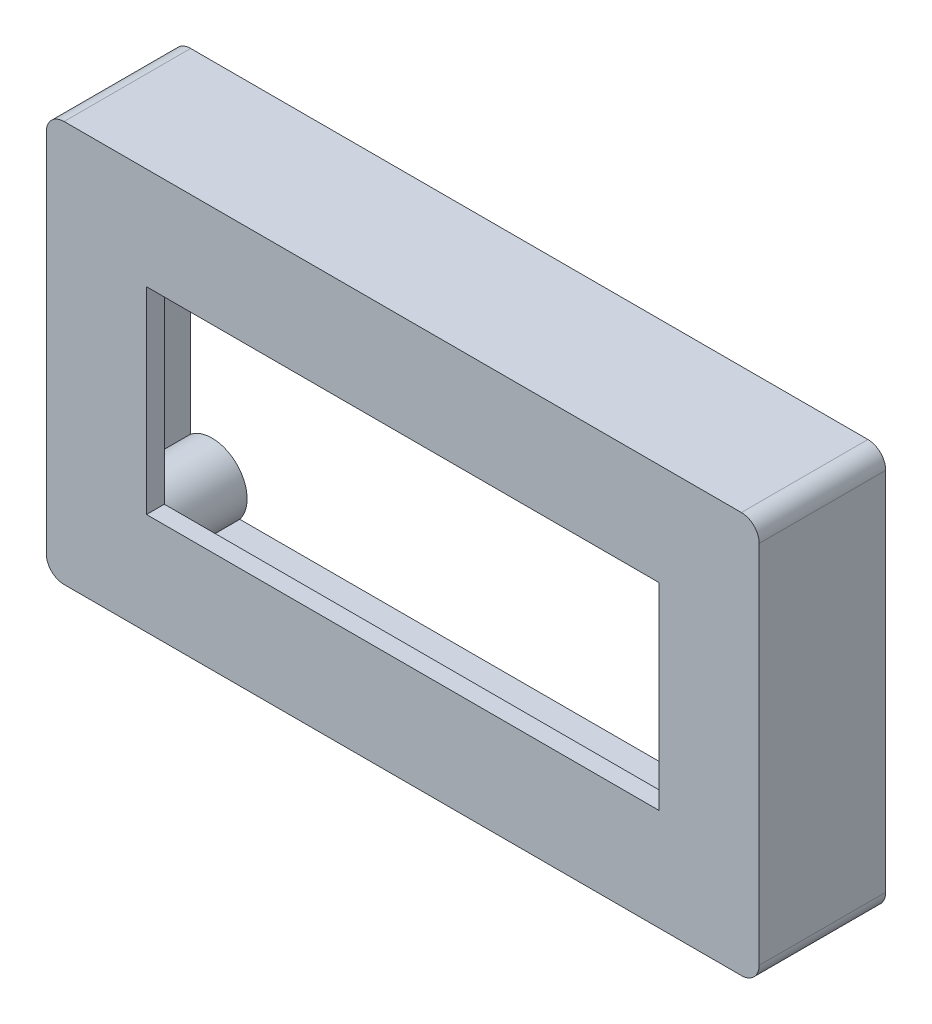
from build123d import *

# Parameters (mm, degrees)
SKETCH1_W           = 101.6
SKETCH1_H           = 57.15
SKETCH1_W_2         = 96.52
SKETCH1_H_2         = 52.07
BOSS_EXTRUDE1_DEPTH = 15.494
SKETCH2_W           = 101.6
SKETCH2_H           = 57.15
SKETCH2_W_2         = 73.025
SKETCH2_H_2         = 28.1178
BOSS_EXTRUDE2_DEPTH = 2.54
SKETCH3_R           = 5
BOSS_EXTRUDE3_DEPTH = 15.494
SKETCH4_R           = 2.415
CUT_EXTRUDE1_DEPTH  = 6.35
SKETCH5_R           = 1.5
CUT_EXTRUDE2_DEPTH  = 7.874
FILLET1_R           = 2.54


with BuildPart() as part:
    # Sketch1 → Boss-Extrude1 (new body)
    with BuildSketch(Plane.XY):
        Rectangle(SKETCH1_W, SKETCH1_H)
        Rectangle(SKETCH1_W_2, SKETCH1_H_2, mode=Mode.SUBTRACT)
    extrude(amount=BOSS_EXTRUDE1_DEPTH)

    # Sketch2 → Boss-Extrude2 (add)
    with BuildSketch(Plane.XY.offset(15.494)):
        Rectangle(SKETCH2_W, SKETCH2_H)
        Rectangle(SKETCH2_W_2, SKETCH2_H_2, mode=Mode.SUBTRACT)
    extrude(amount=BOSS_EXTRUDE2_DEPTH)

    # Sketch3 → Boss-Extrude3 (add)
    with BuildSketch(Plane(origin=(0, 0, 15.494), x_dir=(-1, 0, 0), z_dir=(0, 0, -1))):
        with BuildLine():
            ThreePointArc((-48.26, 19.023454113), (-43.002927797, 18.501467702), (-40.212, 22.987))
            ThreePointArc((-40.212, 22.987), (-40.478199759, 24.59670037), (-41.248454113, 26.035))
            Line((-41.248454113, 26.035), (-48.26, 26.035))
            Line((-48.26, 26.035), (-48.26, 19.023454113))
        make_face()
        with BuildLine():
            Line((-48.26, 26.035), (-41.248454113, 26.035))
            ThreePointArc((-41.248454113, 26.035), (-48.747533906, 26.522533906), (-48.26, 19.023454113))
            Line((-48.26, 19.023454113), (-48.26, 26.035))
        make_face()
        with BuildLine():
            Line((48.26, 26.035), (41.248454113, 26.035))
            ThreePointArc((41.248454113, 26.035), (41.676466094, 19.451466094), (48.26, 19.023454113))
            Line((48.26, 19.023454113), (48.26, 26.035))
        make_face()
        with BuildLine():
            ThreePointArc((50.212, 22.987), (46.82170037, 27.720800241), (41.248454113, 26.035))
            Line((41.248454113, 26.035), (48.26, 26.035))
            Line((48.26, 26.035), (48.26, 19.023454113))
            ThreePointArc((48.26, 19.023454113), (49.697532298, 20.777927797), (50.212, 22.987))
        make_face()
        with BuildLine():
            Line((-48.26, -26.035), (-48.26, -19.023454113))
            ThreePointArc((-48.26, -19.023454113), (-48.747533906, -26.522533906), (-41.248454113, -26.035))
            Line((-41.248454113, -26.035), (-48.26, -26.035))
        make_face()
        with BuildLine():
            ThreePointArc((-40.212, -22.987), (-43.002927797, -18.501467702), (-48.26, -19.023454113))
            Line((-48.26, -19.023454113), (-48.26, -26.035))
            Line((-48.26, -26.035), (-41.248454113, -26.035))
            ThreePointArc((-41.248454113, -26.035), (-40.478199759, -24.59670037), (-40.212, -22.987))
        make_face()
        with Locations((45.212, -22.987)):
            Circle(SKETCH3_R)
    extrude(amount=BOSS_EXTRUDE3_DEPTH)

    # Sketch4 → Cut-Extrude1 (cut)
    with BuildSketch(Plane(origin=(0, 0, 0), x_dir=(-1, 0, 0), z_dir=(0, 0, -1))):
        with Locations((-45.212, 22.987)):
            Circle(SKETCH4_R)
        with Locations((-45.212, -22.987)):
            Circle(SKETCH4_R)
        with Locations((45.212, -22.987)):
            Circle(SKETCH4_R)
        with Locations((45.212, 22.987)):
            Circle(SKETCH4_R)
    extrude(amount=-CUT_EXTRUDE1_DEPTH, mode=Mode.SUBTRACT)

    # Sketch5 → Cut-Extrude2 (cut)
    with BuildSketch(Plane(origin=(0, 0, 6.35), x_dir=(-1, 0, 0), z_dir=(0, 0, -1))):
        with Locations((-45.212, 22.987)):
            Circle(SKETCH5_R)
        with Locations((45.212, -22.987)):
            Circle(SKETCH5_R)
        with Locations((-45.212, -22.987)):
            Circle(SKETCH5_R)
        with Locations((45.212, 22.987)):
            Circle(SKETCH5_R)
    extrude(amount=-CUT_EXTRUDE2_DEPTH, mode=Mode.SUBTRACT)

    # Sketch6 → Cut-Revolve1 (revolve, cut)
    with BuildSketch(Plane(origin=(0, 22.987, 0), x_dir=(0, 0, -1), z_dir=(0, -1, 0)), mode=Mode.PRIVATE) as cut_revolve1_sk:
        Polygon((0, 48.012), (-6.35, 46.892323673), (-6.35, 45.212), (0, 45.212), align=None)
    revolve(cut_revolve1_sk.sketch.rotate(Axis((45.212, 22.987, 6.35), (0, 0, -1)), 180), axis=Axis((45.212, 22.987, 6.35), (0, 0, -1)), mode=Mode.SUBTRACT)

    # Sketch7 → Cut-Revolve2 (revolve, cut)
    with BuildSketch(Plane(origin=(0, -22.987, 0), x_dir=(0, 0, -1), z_dir=(0, 1, 0))):
        Polygon((0, 48.006), (-6.35, 46.886323673), (-6.35, 45.212), (0, 45.212), align=None)
    revolve(axis=Axis((-45.212, -22.987, 6.35), (0, 0, -1)), mode=Mode.SUBTRACT)

    # Sketch8 → Cut-Revolve3 (revolve, cut)
    with BuildSketch(Plane(origin=(0, 22.987, 0), x_dir=(0, 0, -1), z_dir=(0, 1, 0))):
        Polygon((0, 48.006), (-6.35, 46.886323673), (-6.35, 45.212), (0, 45.212), align=None)
    revolve(axis=Axis((-45.212, 22.987, 6.35), (0, 0, -1)), mode=Mode.SUBTRACT)

    # Sketch9 → Cut-Revolve4 (revolve, cut)
    with BuildSketch(Plane(origin=(0, -22.987, 0), x_dir=(0, 0, -1), z_dir=(0, -1, 0)), mode=Mode.PRIVATE) as cut_revolve4_sk:
        Polygon((0, 48.006), (-6.35, 46.886323673), (-6.35, 45.212), (0, 45.212), align=None)
    revolve(cut_revolve4_sk.sketch.rotate(Axis((45.212, -22.987, 6.35), (0, 0, -1)), 180), axis=Axis((45.212, -22.987, 6.35), (0, 0, -1)), mode=Mode.SUBTRACT)

    # Fillet1
    fillet1_edges = [part.edges().sort_by_distance(p)[0] for p in [
        (-50.8, 28.575, 9.017),
        (50.8, 28.575, 9.017),
        (50.8, -28.575, 9.017),
        (-50.8, -28.575, 9.017),
    ]]
    fillet(fillet1_edges, radius=FILLET1_R)


solid = part.part
